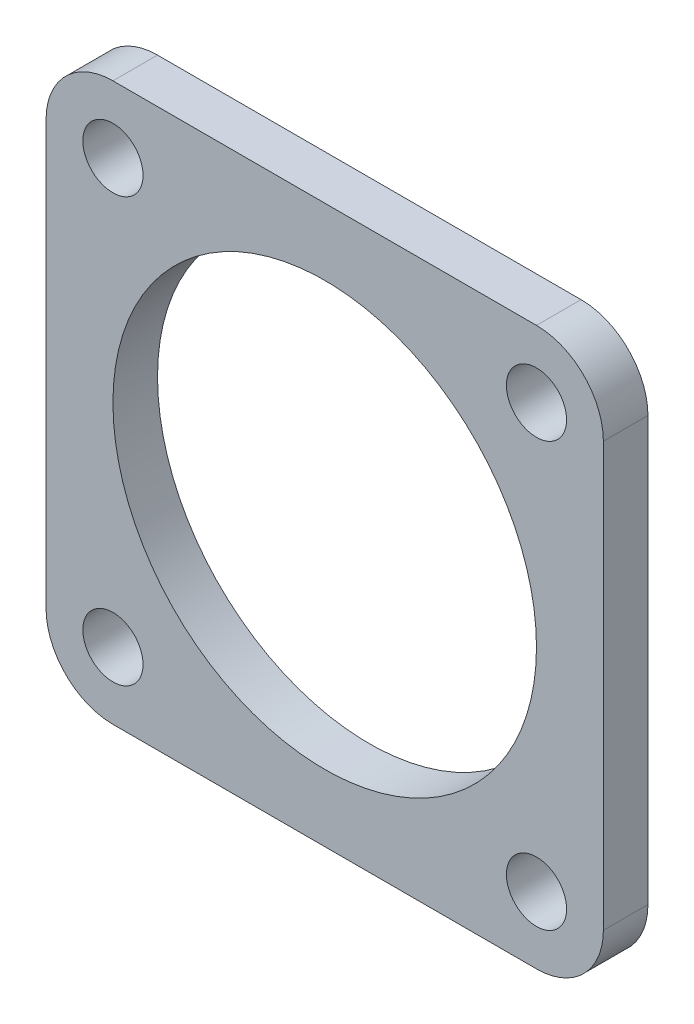
from build123d import *

# Parameters (mm, degrees)
SKETCH1_W           = 25
SKETCH1_H           = 25
SKETCH1_R           = 1.35
SKETCH1_R_2         = 9.5
BOSS_EXTRUDE1_DEPTH = 1
FILLET1_R           = 3


with BuildPart() as part:
    # Sketch1 → Boss-Extrude1 (new, symmetric)
    with BuildSketch(Plane.XY):
        Rectangle(SKETCH1_W, SKETCH1_H)
        with Locations((-9.5, 9.5)):
            Circle(SKETCH1_R, mode=Mode.SUBTRACT)
        with Locations((9.5, 9.5)):
            Circle(SKETCH1_R, mode=Mode.SUBTRACT)
        with Locations((9.5, -9.5)):
            Circle(SKETCH1_R, mode=Mode.SUBTRACT)
        with Locations((-9.5, -9.5)):
            Circle(SKETCH1_R, mode=Mode.SUBTRACT)
        Circle(SKETCH1_R_2, mode=Mode.SUBTRACT)
    extrude(amount=BOSS_EXTRUDE1_DEPTH, both=True)

    # Fillet1
    fillet1_edges = [part.edges().sort_by_distance(p)[0] for p in [
        (12.5, -12.5, 0),
        (-12.5, -12.5, 0),
        (-12.5, 12.5, 0),
        (12.5, 12.5, 0),
    ]]
    fillet(fillet1_edges, radius=FILLET1_R)


solid = part.part
